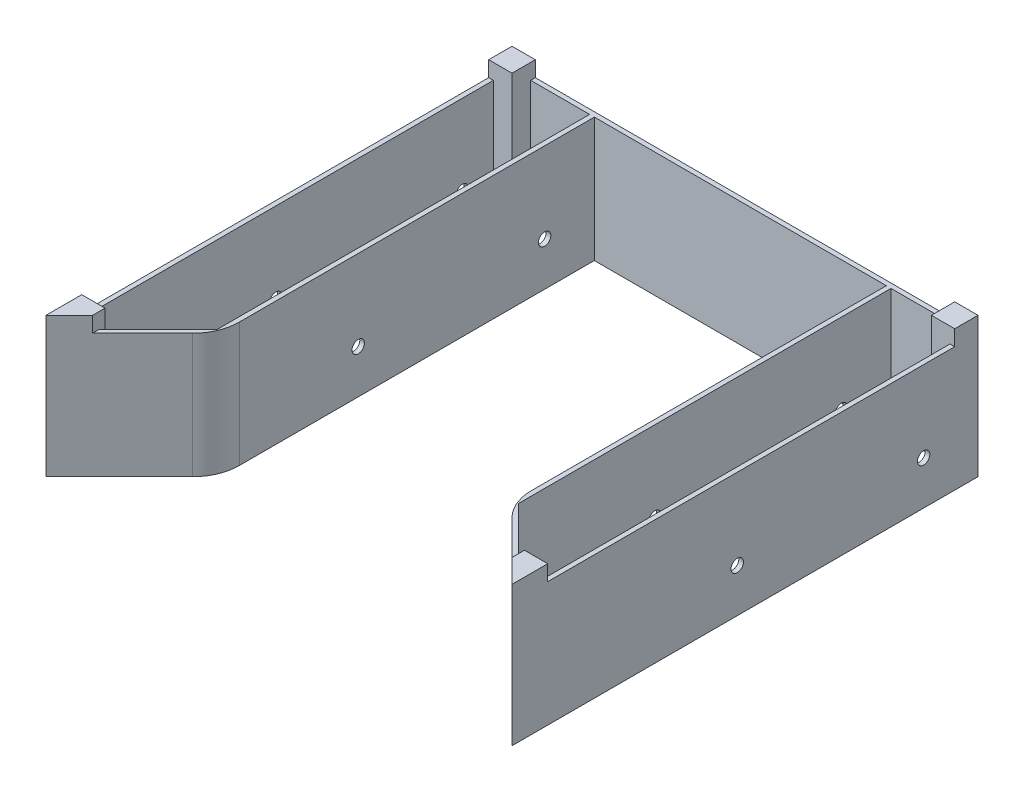
from build123d import *

# Parameters (mm, degrees)
BOSS_EXTRUDE1_DEPTH     = 80
CUT_EXTRUDE1_DEPTH      = 227.715680975
CUT_EXTRUDE1_DEPTH_BACK = 227.715680975
SKETCH2_R               = 4
SKETCH5_W               = 15
SKETCH5_H               = 15
BOSS_EXTRUDE2_DEPTH     = 90
FILLET1_R               = 30


with BuildPart() as part:
    # Sketch1 → Boss-Extrude1 (new body)
    with BuildSketch(Plane(origin=(0, 0, 0), x_dir=(1, 0, 0), z_dir=(0, 1, 0))):
        Polygon((-150, 150), (150, 150), (150, -150), (94, -94), (94, 147), (-94, 147), (-94, -94), (-150, -150), align=None)
        Polygon((-147, 147), (-97, 147), (-97, -92.757359313), (-147, -142.757359313), align=None, mode=Mode.SUBTRACT)
        Polygon((147, 147), (147, -142.757359313), (97, -92.757359313), (97, 147), align=None, mode=Mode.SUBTRACT)
    extrude(amount=BOSS_EXTRUDE1_DEPTH)

    # Sketch2 → Cut-Extrude1 (cut, two sides: drawn at the far end of the back side and taken through both)
    with BuildSketch(Plane(origin=(0, 0, 0), x_dir=(0, 0, -1), z_dir=(1, 0, 0)).offset(-CUT_EXTRUDE1_DEPTH_BACK)):
        with Locations((115, 28)):
            Circle(SKETCH2_R)
        with Locations((-5, 28)):
            Circle(SKETCH2_R)
    extrude(amount=CUT_EXTRUDE1_DEPTH + CUT_EXTRUDE1_DEPTH_BACK, mode=Mode.SUBTRACT)

    # Sketch5 → Boss-Extrude2 (add)
    with BuildSketch(Plane(origin=(0, 0, 0), x_dir=(1, 0, 0), z_dir=(0, 1, 0))):
        Polygon((-150, -127), (-135, -127), (-135, -135), (-150, -150), (-150, -140.427238406), align=None)
        Polygon((150, -150), (135, -135), (135, -127), (150, -127), (150, -140.427238406), align=None)
        with Locations((142.5, 142.5)):
            Rectangle(SKETCH5_W, SKETCH5_H)
        with Locations((-142.5, 142.5)):
            Rectangle(SKETCH5_W, SKETCH5_H)
    extrude(amount=BOSS_EXTRUDE2_DEPTH)

    # Fillet1
    fillet1_edges = [part.edges().sort_by_distance(p)[0] for p in [
        (94, 40, 94),
        (-94, 40, 94),
    ]]
    fillet(fillet1_edges, radius=FILLET1_R)


solid = part.part
